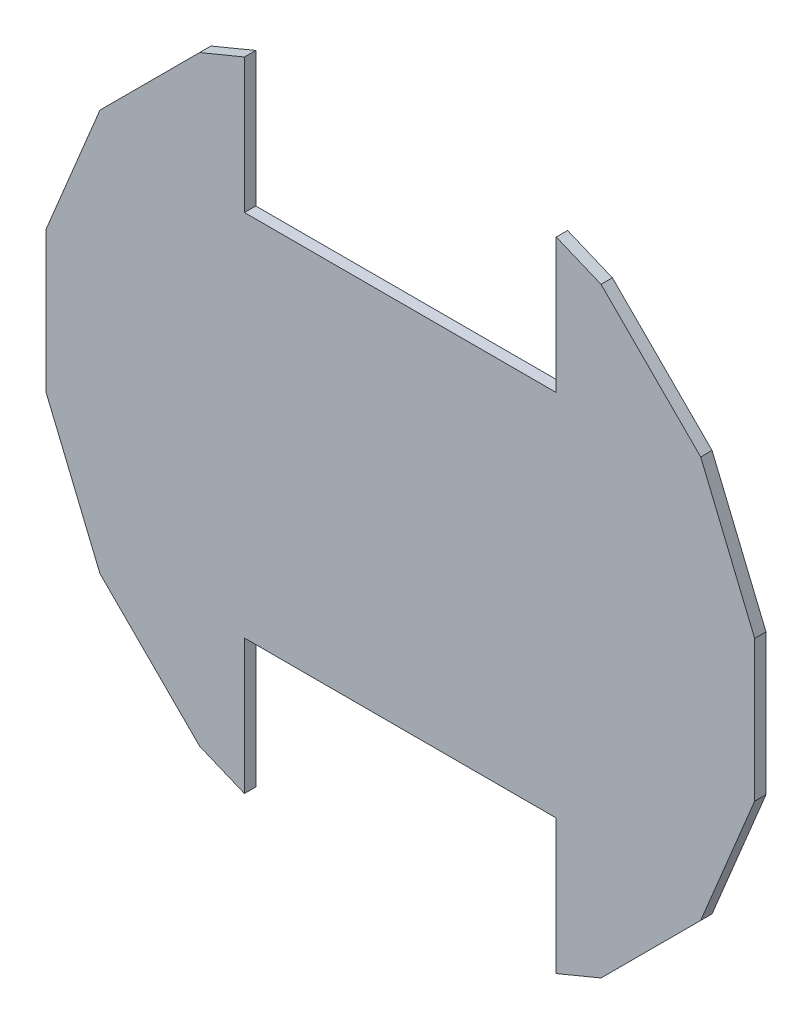
from build123d import *

# Parameters (mm, degrees)
EXTRUDE_1_DEPTH = 1.6


with BuildPart() as part:
    # 草图1 → 凸台-拉伸1 (new body)
    with BuildSketch(Plane.XY):
        Polygon((-22, -45.006911642), (-22, -26), (22, -26), (22, -45.006911642), (28.322724868, -42.387953251), (42.387953251, -28.322724868), (50, -9.945618369), (50, 9.945618369), (42.387953251, 28.322724868), (28.322724868, 42.387953251), (22, 45.006911642), (22, 26), (-22, 26), (-22, 45.006911642), (-28.322724868, 42.387953251), (-42.387953251, 28.322724868), (-50, 9.945618369), (-50, -9.945618369), (-42.387953251, -28.322724868), (-28.322724868, -42.387953251), align=None)
    extrude(amount=EXTRUDE_1_DEPTH)


solid = part.part
